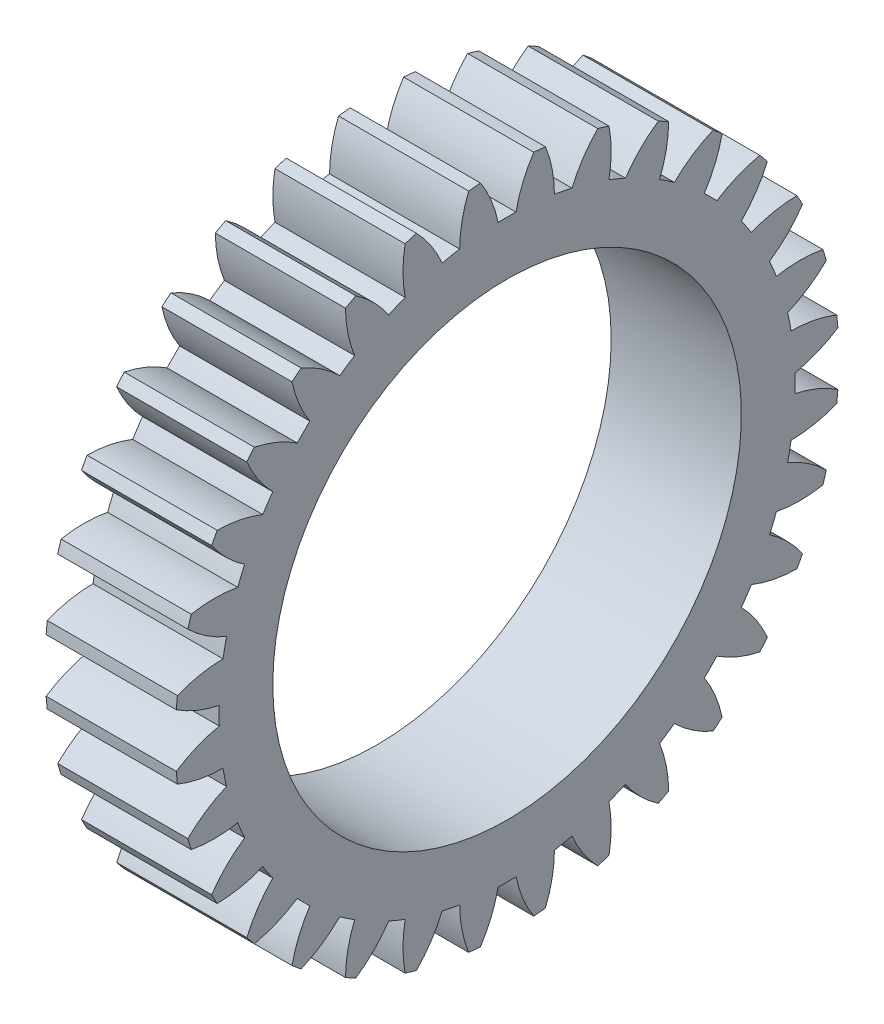
from build123d import *

# Parameters (mm, degrees)
BASPROSKE_W     = 10
BASPROSKE_H     = 25.5
TOOTHCUT_DEPTH  = 38.423254802
TEETHCUTS_COUNT = 32
TEETHCUTS_ANGLE = 348.75
BORSKE_R        = 18
BORE_DEPTH      = 50.0000508


with BuildPart() as part:
    # BasProSke → Base-Revolve (revolve)
    with BuildSketch(Plane(origin=(0, 0, 0), x_dir=(1, 0, 0), z_dir=(0, 1, 0)), mode=Mode.PRIVATE) as base_revolve_sk:
        with Locations((5, 12.75)):
            Rectangle(BASPROSKE_W, BASPROSKE_H)
    revolve(base_revolve_sk.sketch.rotate(Axis((-10, 0, 0), (1, 0, 0)), 180), axis=Axis((-10, 0, 0), (1, 0, 0)))

    # TooCutSke → ToothCut (cut, through all)
    with BuildSketch(Plane(origin=(0, 0, 0), x_dir=(0, 0, -1), z_dir=(1, 0, 0))):
        with BuildLine():
            ThreePointArc((0.686701955, 22.113340237), (0, 22.124), (-0.686701955, 22.113340237))
            ThreePointArc((-0.686701955, 22.113340237), (-1.218174602, 23.842764806), (-2.064691256, 25.441758885))
            ThreePointArc((-2.064691256, 25.441758885), (0, 25.5254), (2.064691256, 25.441758885))
            ThreePointArc((2.064691256, 25.441758885), (1.218174602, 23.842764806), (0.686701955, 22.113340237))
        make_face()
    toothcut = extrude(amount=TOOTHCUT_DEPTH, mode=Mode.SUBTRACT)

    # TeethCuts: ToothCut ×32 about axis
    teethcuts_axis = Axis((-10, 0, 0), (1, 0, 0))
    for i in range(1, TEETHCUTS_COUNT):
        add(toothcut.rotate(teethcuts_axis, i * TEETHCUTS_ANGLE / (TEETHCUTS_COUNT - 1)), mode=Mode.SUBTRACT)

    # BorSke → Bore (cut, symmetric)
    with BuildSketch(Plane(origin=(0, 0, 0), x_dir=(0, 0, -1), z_dir=(1, 0, 0))):
        with Locations(Location((0, 0, 0), (0, 0, 180))):
            Circle(BORSKE_R)
    extrude(amount=BORE_DEPTH, both=True, mode=Mode.SUBTRACT)


solid = part.part
